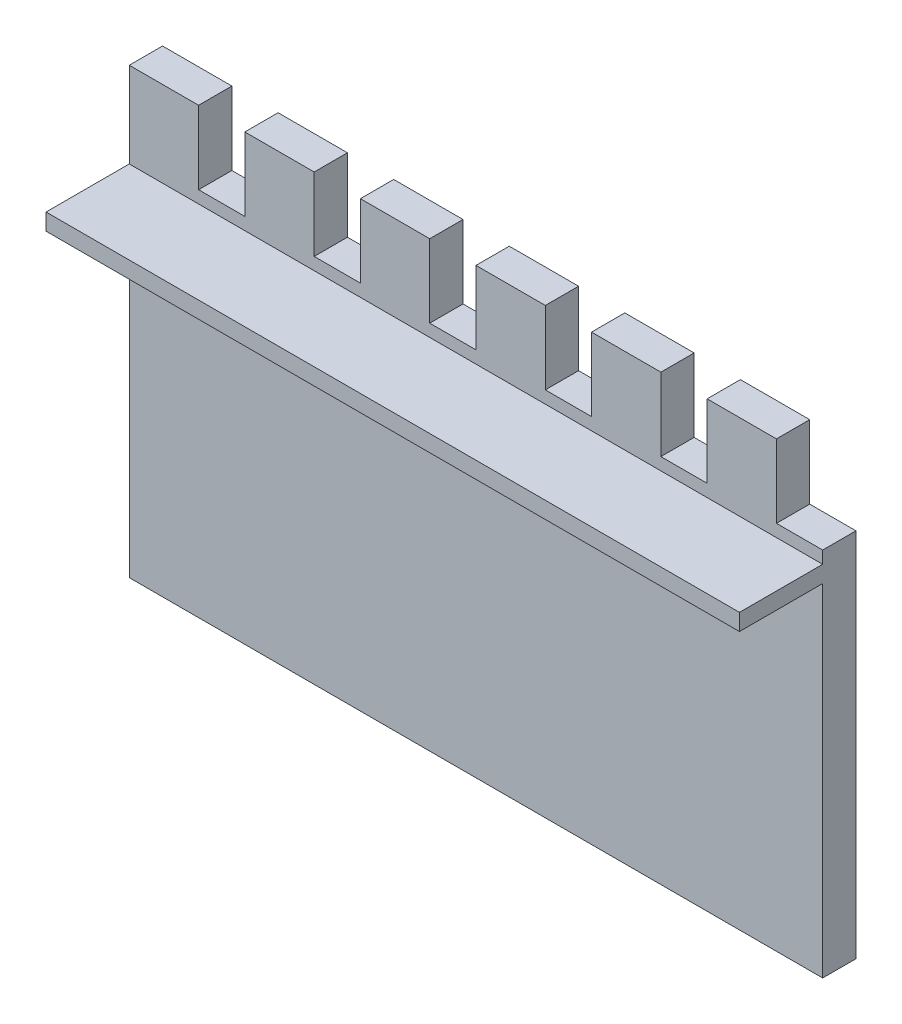
from build123d import *

# Parameters (mm, degrees)
SKETCH1_W           = 38100
SKETCH1_H           = 24384
BOSS_EXTRUDE1_DEPTH = 1828.8
SKETCH2_W           = 2540
SKETCH2_H           = 4019.249447419
CUT_EXTRUDE2_DEPTH  = 1828.8
SKETCH3_W           = 38100
SKETCH3_H           = 914.4
BOSS_EXTRUDE3_DEPTH = 4572


with BuildPart() as part:
    # Sketch1 → Boss-Extrude1 (new body)
    with BuildSketch(Plane.XY):
        with Locations((19050, 12192)):
            Rectangle(SKETCH1_W, SKETCH1_H)
    extrude(amount=BOSS_EXTRUDE1_DEPTH)

    # Sketch2 → Cut-Extrude2 (cut)
    with BuildSketch(Plane.XY.offset(1828.8)):
        with Locations((5080, 22374.37527629)):
            Rectangle(SKETCH2_W, SKETCH2_H)
        Polygon((11430, 24384), (10160, 24384), (10160, 20364.750552581), (12700, 20364.750552581), (12700, 24384), align=None)
        with Locations((17780, 22374.37527629)):
            Rectangle(SKETCH2_W, SKETCH2_H)
        with Locations((24130, 22374.37527629)):
            Rectangle(SKETCH2_W, SKETCH2_H)
        with Locations((30480, 22374.37527629)):
            Rectangle(SKETCH2_W, SKETCH2_H)
        with Locations((36830, 22374.37527629)):
            Rectangle(SKETCH2_W, SKETCH2_H)
    extrude(amount=-CUT_EXTRUDE2_DEPTH, mode=Mode.SUBTRACT)

    # Sketch3 → Boss-Extrude3 (add)
    with BuildSketch(Plane.XY.offset(1828.8)):
        with Locations((19050, 19228.508963642)):
            Rectangle(SKETCH3_W, SKETCH3_H)
    extrude(amount=BOSS_EXTRUDE3_DEPTH)


solid = part.part
